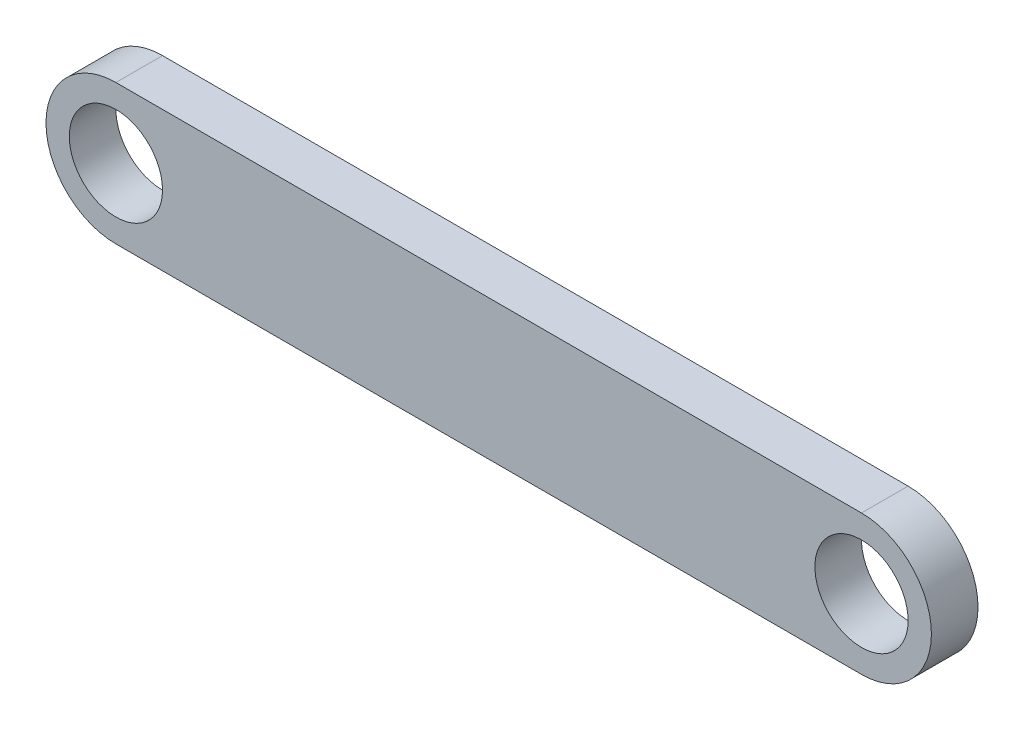
from build123d import *

# Parameters (mm, degrees)
SKETCH_1_R      = 10
EXTRUDE_1_DEPTH = 10


with BuildPart() as part:
    # Эскиз1 → Бобышка-Вытянуть1 (new body)
    with BuildSketch(Plane.XY):
        with BuildLine():
            Line((0, 15), (160, 15))
            ThreePointArc((160, 15), (175, 0), (160, -15))
            Line((160, -15), (0, -15))
            ThreePointArc((0, -15), (-15, 0), (0, 15))
        make_face()
        Circle(SKETCH_1_R, mode=Mode.SUBTRACT)
        with Locations((160, 0)):
            Circle(SKETCH_1_R, mode=Mode.SUBTRACT)
    extrude(amount=EXTRUDE_1_DEPTH)


solid = part.part
